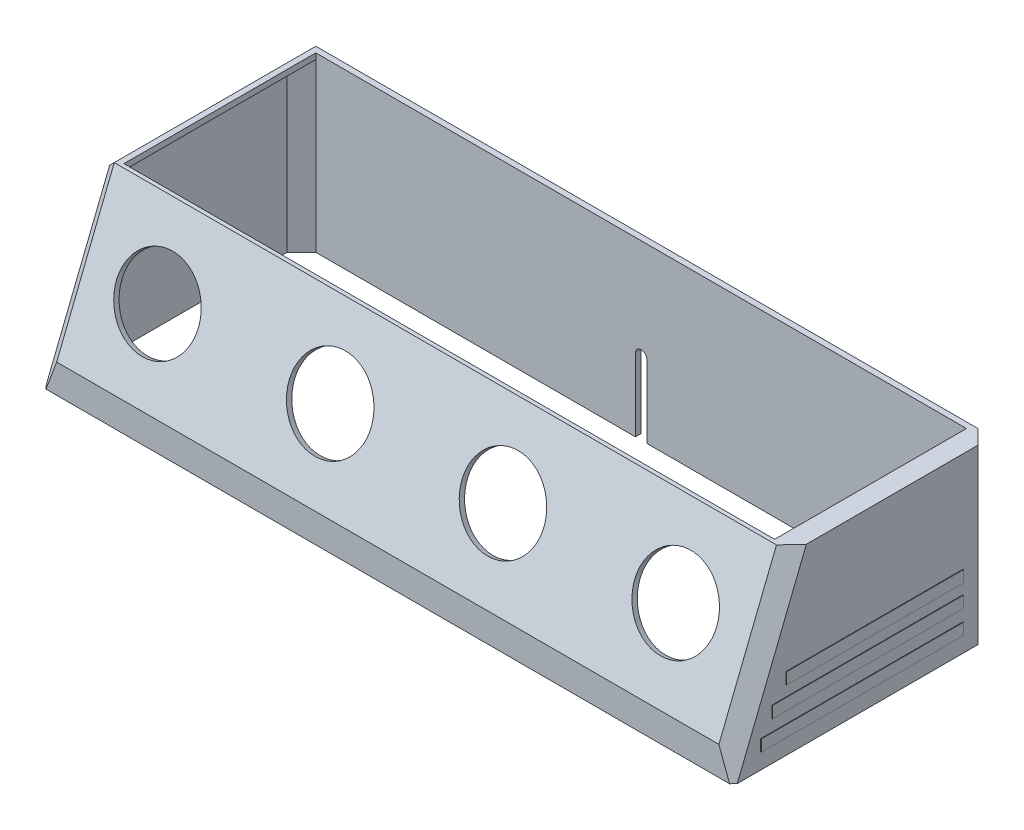
from build123d import *

# Parameters (mm, degrees)
CROQUIS1_W              = 240
CROQUIS1_H              = 90
SALIENTE_EXTRUIR1_DEPTH = 60
CORTAR_EXTRUIR1_DEPTH   = 240
VACIADO1_T              = -2
CROQUIS3_R              = 14.25
CORTAR_EXTRUIR2_DEPTH   = 2
CHAFL_N1_SIZE           = 5
CROQUIS6_W              = 226
CROQUIS6_H              = 66.645934077
CORTAR_EXTRUIR6_DEPTH   = 2
CROQUIS4_W              = 70.201214056
CROQUIS4_H              = 4
CROQUIS4_W_2            = 66.358621287
CROQUIS4_W_3            = 61.48148431
SALIENTE_EXTRUIR4_DEPTH = 0.2
CROQUIS7_W              = 61.48148431
CROQUIS7_H              = 4
CROQUIS7_W_2            = 66.358621287
CROQUIS7_W_3            = 70.201214056
CORTAR_EXTRUIR7_DEPTH   = 0.2
CORTAR_EXTRUIR8_DEPTH   = 10


with BuildPart() as part:
    # Croquis1 → Saliente-Extruir1 (new body)
    with BuildSketch(Plane(origin=(0, 0, 0), x_dir=(1, 0, 0), z_dir=(0, 1, 0))):
        Rectangle(CROQUIS1_W, CROQUIS1_H)
    extrude(amount=SALIENTE_EXTRUIR1_DEPTH)

    # Croquis2 → Cortar-Extruir1 (cut)
    with BuildSketch(Plane(origin=(120, 0, 0), x_dir=(0, 0, -1), z_dir=(1, 0, 0))):
        Polygon((-45, 10), (-25, 60), (-45, 60), align=None)
    extrude(amount=-CORTAR_EXTRUIR1_DEPTH, mode=Mode.SUBTRACT)

    # Vaciado1
    vaciado1_openings = [part.faces().sort_by_distance(p)[0] for p in [
        (0, 0, 0),
    ]]
    offset(amount=VACIADO1_T, openings=vaciado1_openings, kind=Kind.INTERSECTION)

    # Croquis3 → Cortar-Extruir2 (cut)
    with BuildSketch(Plane(origin=(0, 16.896551724, 42.24137931), x_dir=(1, 0, 0), z_dir=(0, 0.3713906763541038, 0.9284766908852594))):
        with Locations(Location((-90, 19.498010509, 0), (0, 0, 270))):
            Circle(CROQUIS3_R)
        with Locations(Location((-30, 19.498010509, 0), (0, 0, 270))):
            Circle(CROQUIS3_R)
        with Locations(Location((30, 19.498010509, 0), (0, 0, 270))):
            Circle(CROQUIS3_R)
        with Locations(Location((90, 19.498010509, 0), (0, 0, 270))):
            Circle(CROQUIS3_R)
    extrude(amount=-CORTAR_EXTRUIR2_DEPTH, mode=Mode.SUBTRACT)

    # Chaflán1
    chafl_n1_edges = [part.edges().sort_by_distance(p)[0] for p in [
        (-120, 35, 35),
        (-118, 33.807417596, 33.322967039),
        (118, 33.807417596, 33.322967039),
        (120, 35, 35),
        (-120, 60, -10),
        (-120, 30, -45),
        (-118, 29, -43),
        (-118, 58, -9.677032961),
        (118, 58, -9.677032961),
        (120, 30, -45),
        (118, 29, -43),
    ]]
    chamfer(chafl_n1_edges, length=CHAFL_N1_SIZE)

    # Croquis6 → Cortar-Extruir6 (cut)
    with BuildSketch(Plane.XZ.offset(-58)):
        with Locations((0, -9.677032962)):
            Rectangle(CROQUIS6_W, CROQUIS6_H)
    extrude(amount=-CORTAR_EXTRUIR6_DEPTH, mode=Mode.SUBTRACT)

    # Croquis4 → Saliente-Extruir4 (add)
    with BuildSketch(Plane(origin=(120, 0, 0), x_dir=(0, 0, -1), z_dir=(1, 0, 0))):
        with Locations((-0.369480074, 7.456907887)):
            Rectangle(CROQUIS4_W, CROQUIS4_H)
        with Locations((1.551816311, 15.595084715)):
            Rectangle(CROQUIS4_W_2, CROQUIS4_H)
        with Locations((3.990384799, 23.280270254)):
            Rectangle(CROQUIS4_W_3, CROQUIS4_H)
    extrude(amount=SALIENTE_EXTRUIR4_DEPTH)

    # Croquis7 → Cortar-Extruir7 (cut)
    with BuildSketch(Plane.ZY.offset(120)):
        with Locations((-3.990384799, 23.280270254)):
            Rectangle(CROQUIS7_W, CROQUIS7_H)
        with Locations((-1.551816311, 15.595084715)):
            Rectangle(CROQUIS7_W_2, CROQUIS7_H)
        with Locations((0.369480074, 7.456907887)):
            Rectangle(CROQUIS7_W_3, CROQUIS7_H)
    extrude(amount=-CORTAR_EXTRUIR7_DEPTH, mode=Mode.SUBTRACT)

    # Croquis9 → Cortar-Extruir8 (cut)
    with BuildSketch(Plane(origin=(0, 0, -45), x_dir=(-1, 0, 0), z_dir=(0, 0, -1))):
        with BuildLine():
            Line((-2, 0), (2, 0))
            Line((2, 0), (2, 25.227603125))
            ThreePointArc((2, 25.227603125), (0, 27.227603125), (-2, 25.227603125))
            Line((-2, 25.227603125), (-2, 0))
        make_face()
    extrude(amount=-CORTAR_EXTRUIR8_DEPTH, mode=Mode.SUBTRACT)


solid = part.part
